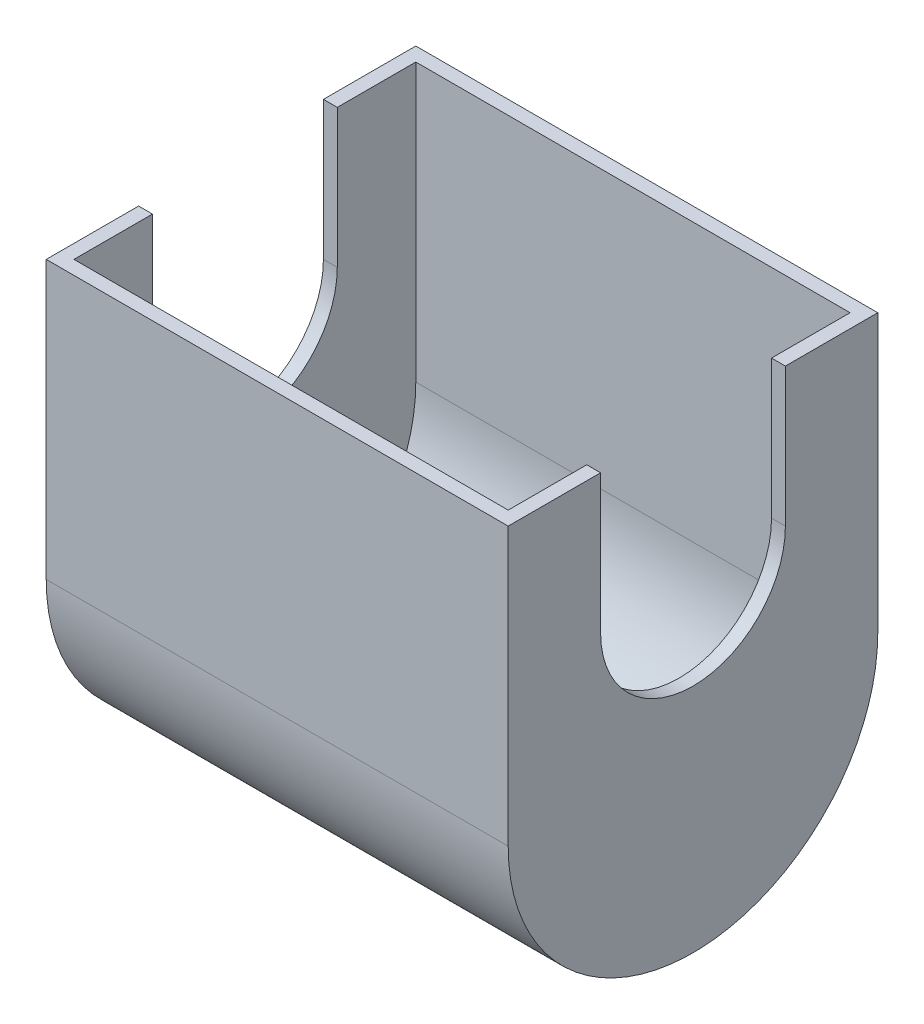
from build123d import *

# Parameters (mm, degrees)
BOSS_EXTRUDE2_DEPTH = 100
SHELL1_T            = -3


with BuildPart() as part:
    # Sketch1 → Boss-Extrude2 (new body)
    with BuildSketch(Plane(origin=(0, 0, 0), x_dir=(0, 0, -1), z_dir=(1, 0, 0))):
        with BuildLine():
            Line((40, 0), (40, -60))
            ThreePointArc((40, -60), (0, -100), (-40, -60))
            Line((-40, -60), (-40, 0))
            Line((-40, 0), (-20, 0))
            Line((-20, 0), (-20, -30))
            ThreePointArc((-20, -30), (0, -50), (20, -30))
            Line((20, -30), (20, 0))
            Line((20, 0), (40, 0))
        make_face()
    extrude(amount=BOSS_EXTRUDE2_DEPTH)

    # Shell1
    shell1_openings = [part.faces().sort_by_distance(p)[0] for p in [
        (50, 0, -30),
        (50, -15, -20),
        (50, -50, 0),
        (50, -15, 20),
        (50, 0, 30),
    ]]
    offset(amount=SHELL1_T, openings=shell1_openings, kind=Kind.INTERSECTION)


solid = part.part
